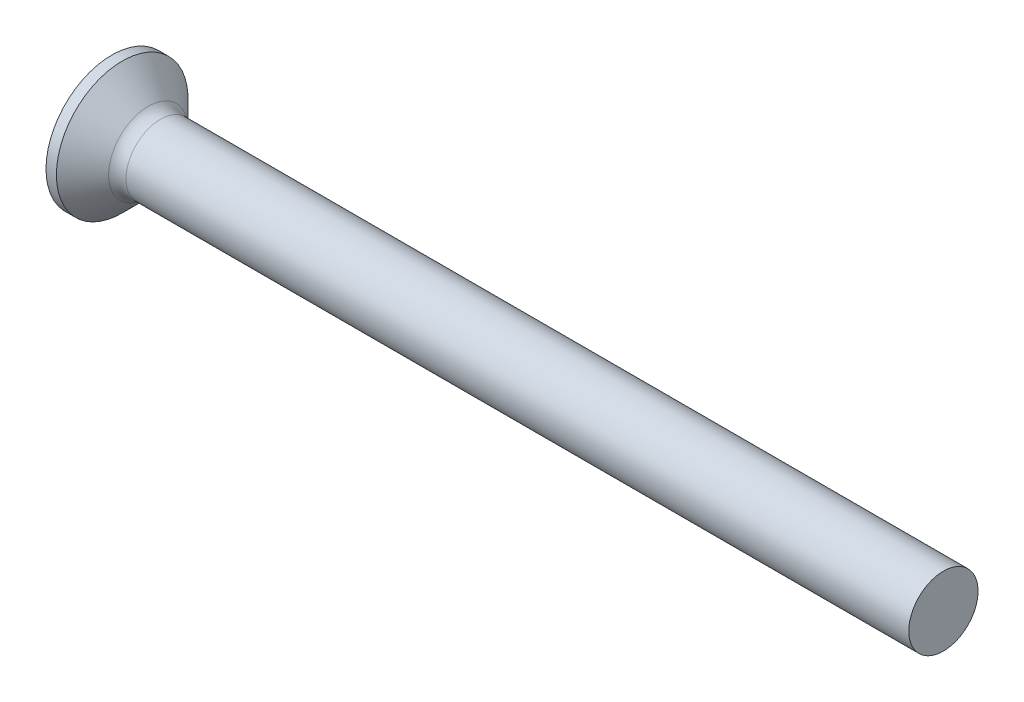
from build123d import *

# Parameters (mm, degrees)
FILLET1_R    = 0.5
RECPAT_COUNT = 2
RECPAT_ANGLE = 90


with BuildPart() as part:
    # BodySke → Base-Revolve (revolve)
    with BuildSketch(Plane.XY, mode=Mode.PRIVATE) as base_revolve_sk:
        Polygon((0, 0), (0, 1.9), (0.3, 1.9), (1.2, 1), (24, 1), (24, 0), align=None)
    revolve(base_revolve_sk.sketch.rotate(Axis((-6.35, 0, 0), (1, 0, 0)), 90), axis=Axis((-6.35, 0, 0), (1, 0, 0)))

    # Fillet1
    fillet1_edges = [part.edges().sort_by_distance(p)[0] for p in [
        (1.2, 0, -1),
    ]]
    fillet(fillet1_edges, radius=FILLET1_R)

    # Sketch3 → Recess section 0
    with BuildSketch(Plane.ZY):
        with BuildLine():
            Line((-0.24, 0.95), (0.24, 0.95))
            Line((0.24, 0.95), (0.24, -0.95))
            Line((0.24, -0.95), (-0.24, -0.95))
            Line((-0.24, -0.95), (-0.24, 0.95))
        make_face()
    # Sketch4 → Recess section 1
    with BuildSketch(Plane.ZY.offset(-1.2)):
        with BuildLine():
            Line((-0.24, 0.35170217), (0.24, 0.35170217))
            Line((0.24, 0.35170217), (0.24, -0.35170217))
            Line((0.24, -0.35170217), (-0.24, -0.35170217))
            Line((-0.24, -0.35170217), (-0.24, 0.35170217))
        make_face()
    recess = loft(mode=Mode.SUBTRACT)

    # RecPat: Recess ×2 about axis
    recpat_axis = Axis((0, 0, 0), (1, 0, 0))
    for i in range(1, RECPAT_COUNT):
        add(recess.rotate(recpat_axis, i * RECPAT_ANGLE / (RECPAT_COUNT - 1)), mode=Mode.SUBTRACT)

    # RecCorSke → RecessCore (revolve, cut)
    with BuildSketch(Plane.XY, mode=Mode.PRIVATE) as recesscore_sk:
        Polygon((0, 0), (0, 0.439412174), (1.2, 0.3555), (1.315508952, 0), align=None)
    revolve(recesscore_sk.sketch.rotate(Axis((-3.175, 0, 0), (1, 0, 0)), 90), axis=Axis((-3.175, 0, 0), (1, 0, 0)), mode=Mode.SUBTRACT)


solid = part.part
